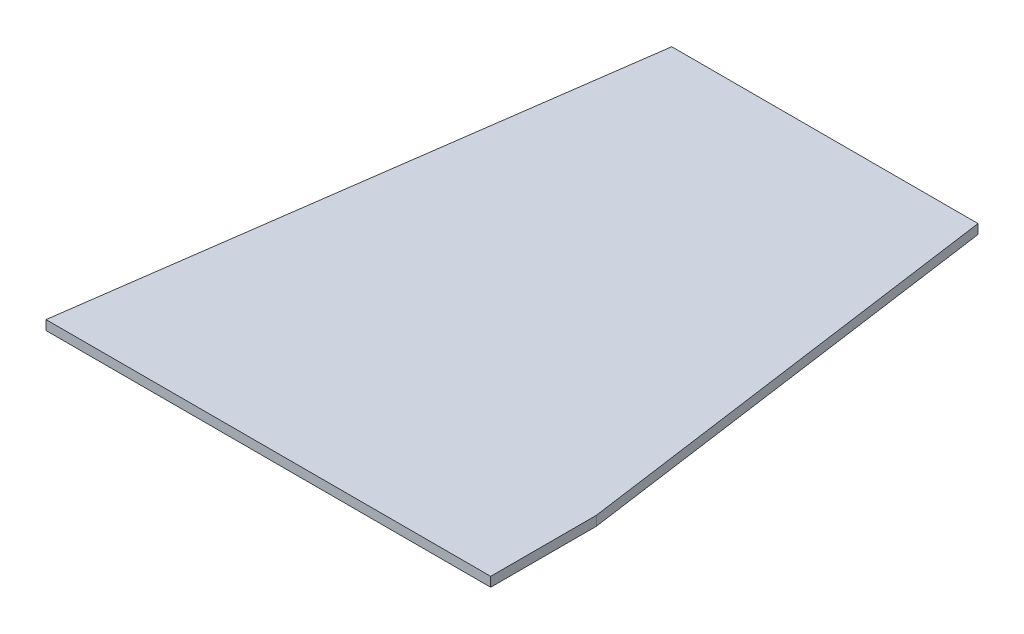
from build123d import *

# Parameters (mm, degrees)
EXTRUDE_1_DEPTH     = 1.8
SKETCH_2_W          = 2.788461538
SKETCH_2_H          = 20
CUT_EXTRUDE_1_DEPTH = 136.603244799


with BuildPart() as part:
    # 草图1 → 凸台-拉伸1 (new body)
    with BuildSketch(Plane(origin=(0, 0, 0), x_dir=(1, 0, 0), z_dir=(0, 1, 0))):
        Polygon((0, 0), (14.5, 104), (72.5, 104), (87, 0), align=None)
    extrude(amount=EXTRUDE_1_DEPTH)

    # 草图2 → 切除-拉伸1 (cut, through all)
    with BuildSketch(Plane(origin=(0, 1.8, 0), x_dir=(1, 0, 0), z_dir=(0, 1, 0))):
        with Locations((85.605769231, 10)):
            Rectangle(SKETCH_2_W, SKETCH_2_H)
    extrude(amount=-CUT_EXTRUDE_1_DEPTH, mode=Mode.SUBTRACT)


solid = part.part
